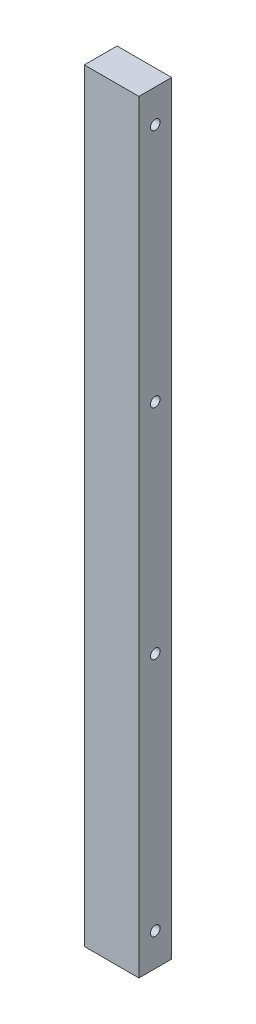
from build123d import *

# Parameters (mm, degrees)
SKETCH_1_W       = 50
SKETCH_1_H       = 700
EXTRUDE_1_DEPTH  = 30
M10X1_25_1_D     = 8.8
M10X1_25_1_DEPTH = 23.75
M10X1_25_1_TIP   = 2.643786724
M12X1_5_1_D      = 10.5
M12X1_5_1_DEPTH  = 28.5
M12X1_5_1_TIP    = 3.15451825


with BuildPart() as part:
    # 草图1 → 凸台-拉伸1 (new body)
    with BuildSketch(Plane.XY):
        with Locations((-25, 350)):
            Rectangle(SKETCH_1_W, SKETCH_1_H)
    extrude(amount=-EXTRUDE_1_DEPTH)

    # M10x1.25 螺纹孔1
    with Locations(Plane(origin=(0, 0, 0), x_dir=(0, 0, -1), z_dir=(1, 0, 0))):
        with Locations((15, 670), (15, 450), (15, 250), (15, 30)):
            Hole(M10X1_25_1_D / 2, depth=M10X1_25_1_DEPTH)
            with Locations((0, 0, -(M10X1_25_1_DEPTH + M10X1_25_1_TIP / 2))):  # 118° drill point
                Cone(0, M10X1_25_1_D / 2, M10X1_25_1_TIP, mode=Mode.SUBTRACT)

    # M12x1.5 螺纹孔1
    with Locations(Plane.ZY.offset(50)):
        with Locations((-15, 535), (-15, 135)):
            Hole(M12X1_5_1_D / 2, depth=M12X1_5_1_DEPTH)
            with Locations((0, 0, -(M12X1_5_1_DEPTH + M12X1_5_1_TIP / 2))):  # 118° drill point
                Cone(0, M12X1_5_1_D / 2, M12X1_5_1_TIP, mode=Mode.SUBTRACT)


solid = part.part
